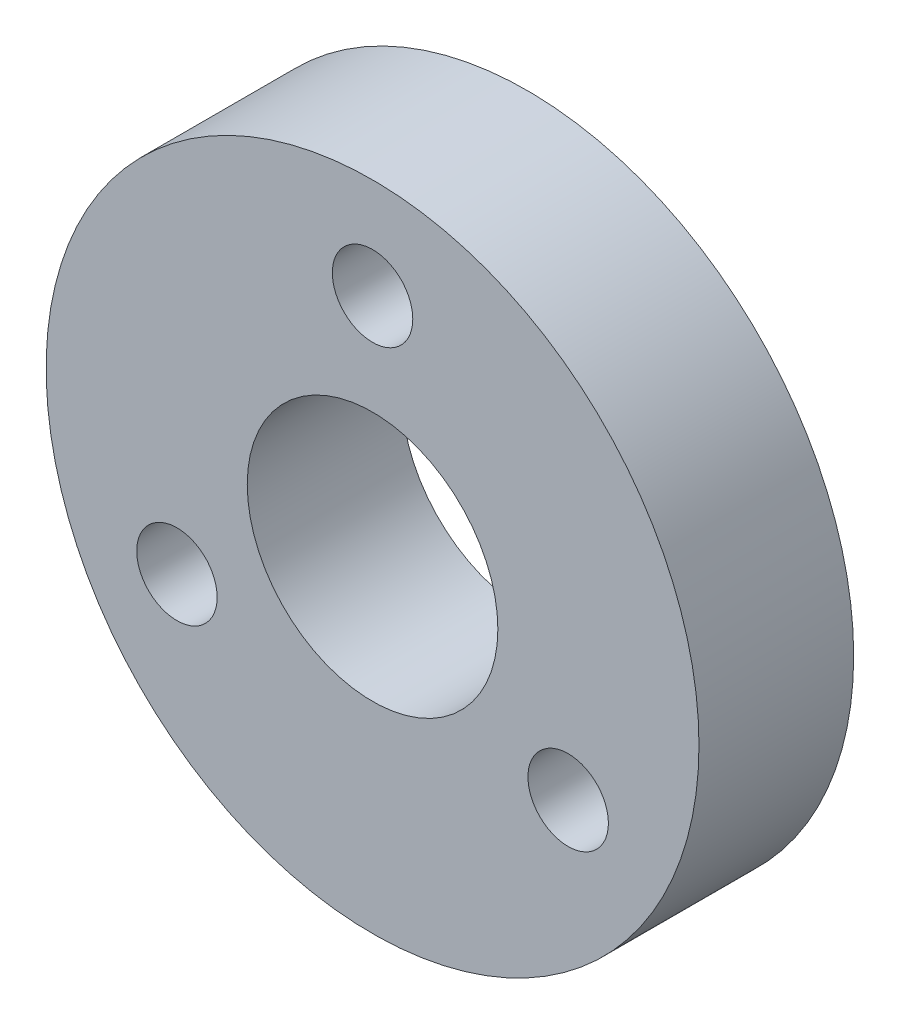
from build123d import *

# Parameters (mm, degrees)
SKETCH1_R           = 10.55
SKETCH1_R_2         = 4.05
SKETCH1_R_3         = 1.3
BOSS_EXTRUDE1_DEPTH = 5


with BuildPart() as part:
    # Sketch1 → Boss-Extrude1 (new body)
    with BuildSketch(Plane.XY):
        Circle(SKETCH1_R)
        Circle(SKETCH1_R_2, mode=Mode.SUBTRACT)
        with Locations((0, 7.3)):
            Circle(SKETCH1_R_3, mode=Mode.SUBTRACT)
        with Locations((6.321985448, -3.65)):
            Circle(SKETCH1_R_3, mode=Mode.SUBTRACT)
        with Locations((-6.321985448, -3.65)):
            Circle(SKETCH1_R_3, mode=Mode.SUBTRACT)
    extrude(amount=BOSS_EXTRUDE1_DEPTH)


solid = part.part
